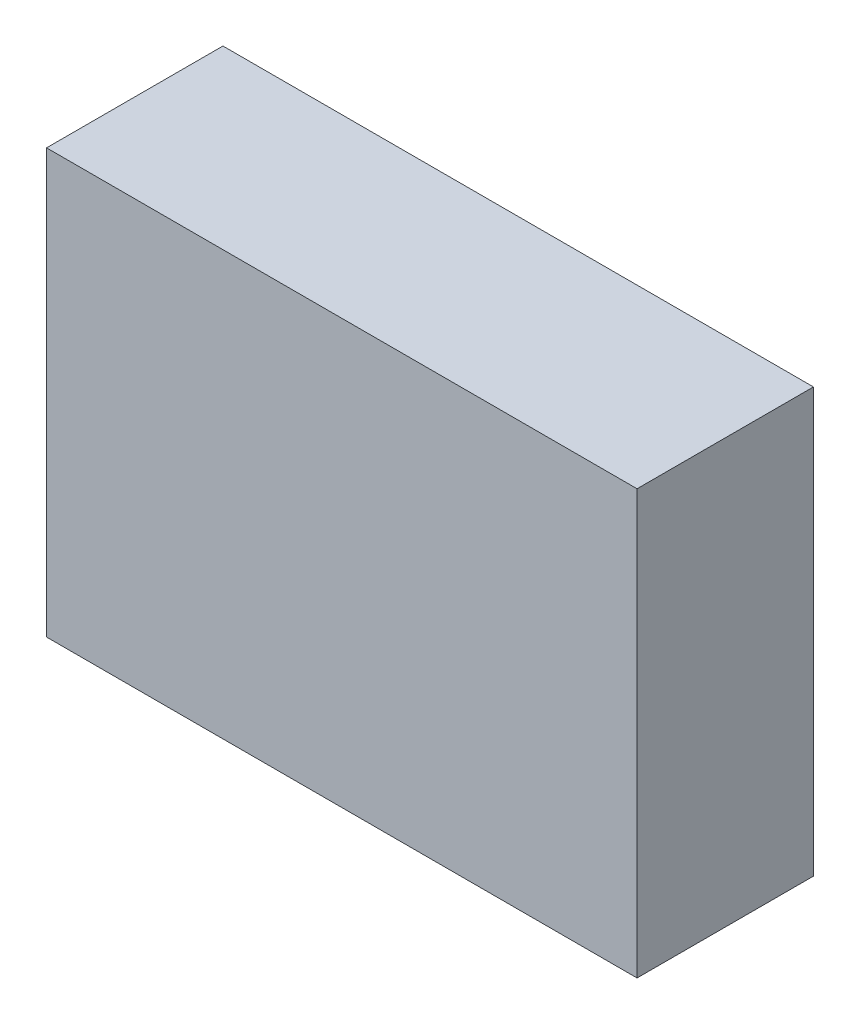
from build123d import *

# Parameters (mm, degrees)
SKETCH1_W           = 30.8
SKETCH1_H           = 22.1
BOSS_EXTRUDE1_DEPTH = 9.2


with BuildPart() as part:
    # Sketch1 → Boss-Extrude1 (new body)
    with BuildSketch(Plane.XY):
        with Locations((15.4, 11.05)):
            Rectangle(SKETCH1_W, SKETCH1_H)
    extrude(amount=BOSS_EXTRUDE1_DEPTH)


solid = part.part
